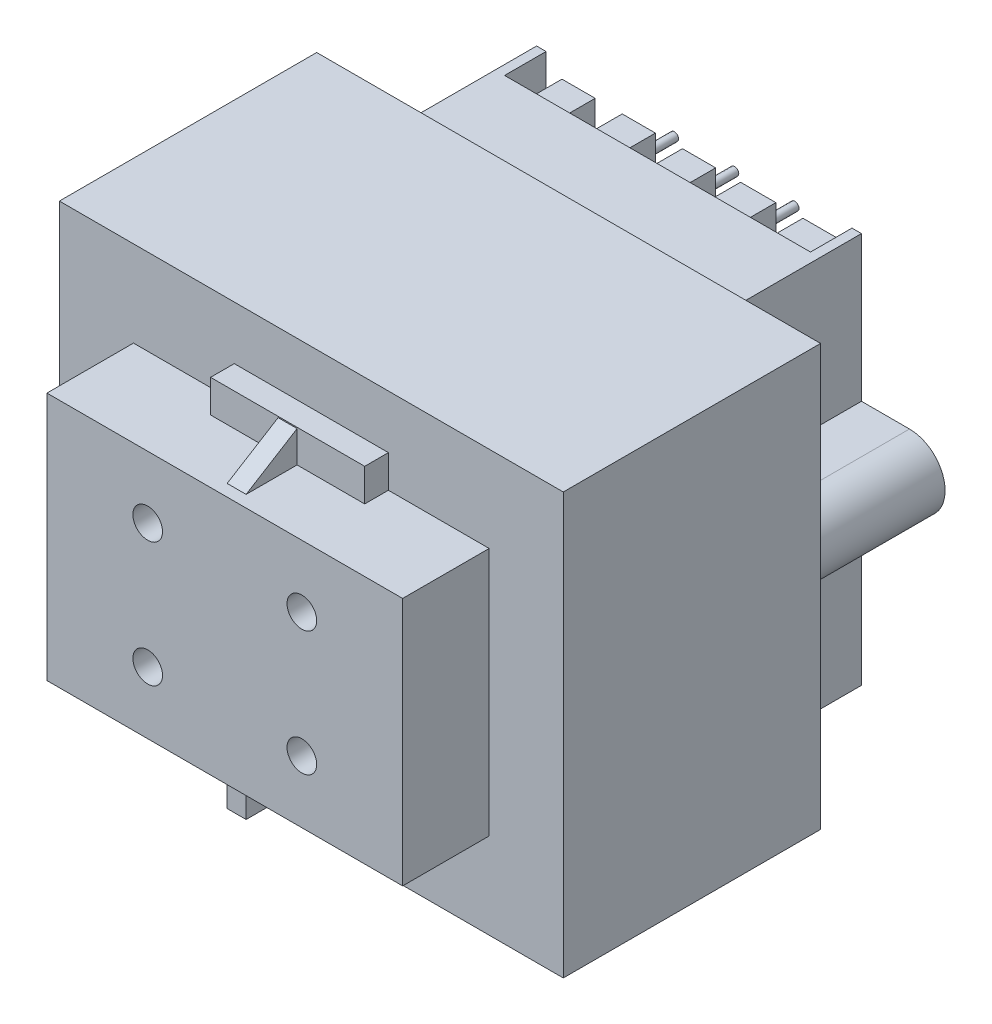
from build123d import *

# Parameters (mm, degrees)
SKETCH_1_W                 = 42.5
SKETCH_1_H                 = 35.5
EXTRUDE_1_DEPTH            = 40
SKETCH_2_W                 = 42.5
SKETCH_2_H                 = 35.5
SKETCH_2_W_2               = 30
SKETCH_2_H_2               = 21
CUT_EXTRUDE_1_DEPTH        = 7.3
SKETCH_3_W                 = 13
SKETCH_3_H                 = 26.5
EXTRUDE_2_DEPTH            = 2
EXTRUDE_3_DEPTH            = 0.8
EXTRUDE_3_DEPTH_BACK       = 0.8
SKETCH_4_W                 = 4.3
SKETCH_4_H                 = 2.75
SKETCH_5_R                 = 1.25
CUT_EXTRUDE_2_DEPTH        = 2
SKETCH_6_W                 = 42.5
SKETCH_6_H                 = 35.5
CUT_EXTRUDE_3_DEPTH        = 11
SKETCH_7_W                 = 2.5
SKETCH_7_H                 = 2.5
CUT_EXTRUDE_4_DEPTH        = 8
SKETCH_8_W                 = 25.8
SKETCH_8_H                 = 4.25
SKETCH_8_H_2               = 6.75
CUT_EXTRUDE_5_DEPTH        = 11
CUT_EXTRUDE_6_DEPTH        = 3.5
SKETCH_10_W                = 2.1
SKETCH_10_H                = 4.65
SKETCH_10_W_2              = 2.28
SKETCH_10_W_3              = 0.939967479
CUT_EXTRUDE_7_DEPTH        = 3.5
SKETCH_11_R                = 0.35
EXTRUDE_4_DEPTH            = 3
PATTERN_LINEAR_1_COUNT     = 3
PATTERN_LINEAR_1_PITCH     = 5.08
PATTERN_LINEAR_1_COL_COUNT = 3
PATTERN_LINEAR_1_COL_PITCH = 5.08
CUT_EXTRUDE_START          = -3
SKETCH_12_R                = 0.35
CUT_EXTRUDE_8_DEPTH        = 3


with BuildPart() as part:
    # Эскиз1 → Вытянуть1 (new body)
    with BuildSketch(Plane.XY):
        Rectangle(SKETCH_1_W, SKETCH_1_H)
    extrude(amount=EXTRUDE_1_DEPTH)

    # Эскиз2 → Вырез-Вытянуть1 (cut)
    with BuildSketch(Plane.XY.offset(40)):
        Rectangle(SKETCH_2_W, SKETCH_2_H)
        Rectangle(SKETCH_2_W_2, SKETCH_2_H_2, mode=Mode.SUBTRACT)
    extrude(amount=-CUT_EXTRUDE_1_DEPTH, mode=Mode.SUBTRACT)

    # Эскиз3 → Вытянуть2 (add)
    with BuildSketch(Plane.XY.offset(32.7)):
        Rectangle(SKETCH_3_W, SKETCH_3_H)
    extrude(amount=EXTRUDE_2_DEPTH)

    # Эскиз4 → Вытянуть3 (add, two sides: drawn at the far end of the back side and taken through both)
    with BuildSketch(Plane(origin=(0, 0, 0), x_dir=(0, 0, -1), z_dir=(1, 0, 0)).offset(-EXTRUDE_3_DEPTH_BACK)):
        Polygon((-34.7, 10.5), (-39, 10.5), (-34.7, 13.153893026), align=None)
        with Locations((-36.85, -11.875)):
            Rectangle(SKETCH_4_W, SKETCH_4_H)
    extrude(amount=EXTRUDE_3_DEPTH + EXTRUDE_3_DEPTH_BACK)

    # Эскиз5 → Вырез-Вытянуть2 (cut)
    with BuildSketch(Plane.XY.offset(40)):
        with Locations((-6.5, 5.25)):
            Circle(SKETCH_5_R)
        with Locations((6.5, 5.25)):
            Circle(SKETCH_5_R)
        with Locations((6.5, -5.25)):
            Circle(SKETCH_5_R)
        with Locations((-6.5, -5.25)):
            Circle(SKETCH_5_R)
    extrude(amount=-CUT_EXTRUDE_2_DEPTH, mode=Mode.SUBTRACT)

    # Эскиз6 → Вырез-Вытянуть3 (cut)
    with BuildSketch(Plane(origin=(0, 0, 0), x_dir=(-1, 0, 0), z_dir=(0, 0, -1))):
        Rectangle(SKETCH_6_W, SKETCH_6_H)
        with BuildLine():
            Line((-17.75, 4.25), (-13.7, 4.25))
            Line((-13.7, 4.25), (-13.7, 16.5))
            Line((-13.7, 16.5), (13.7, 16.5))
            Line((13.7, 16.5), (13.7, 4.25))
            Line((13.7, 4.25), (17.75, 4.25))
            ThreePointArc((17.75, 4.25), (20.75, 1.25), (17.75, -1.75))
            Line((17.75, -1.75), (13.7, -1.75))
            Line((13.7, -1.75), (13.7, -16.5))
            Line((13.7, -16.5), (-13.7, -16.5))
            Line((-13.7, -16.5), (-13.7, -1.75))
            Line((-13.7, -1.75), (-17.75, -1.75))
            ThreePointArc((-17.75, -1.75), (-20.75, 1.25), (-17.75, 4.25))
        make_face(mode=Mode.SUBTRACT)
    extrude(amount=-CUT_EXTRUDE_3_DEPTH, mode=Mode.SUBTRACT)

    # Эскиз7 → Вырез-Вытянуть4 (cut)
    with BuildSketch(Plane(origin=(0, 0, 0), x_dir=(-1, 0, 0), z_dir=(0, 0, -1))):
        with Locations((17.25, 1.25)):
            Rectangle(SKETCH_7_W, SKETCH_7_H)
        with Locations((-17.25, 1.25)):
            Rectangle(SKETCH_7_W, SKETCH_7_H)
    extrude(amount=-CUT_EXTRUDE_4_DEPTH, mode=Mode.SUBTRACT)

    # Эскиз8 → Вырез-Вытянуть5 (cut)
    with BuildSketch(Plane(origin=(0, 0, 0), x_dir=(-1, 0, 0), z_dir=(0, 0, -1))):
        with Locations((0, 8.375)):
            Rectangle(SKETCH_8_W, SKETCH_8_H)
        with Locations((0, -7.125)):
            Rectangle(SKETCH_8_W, SKETCH_8_H_2)
    extrude(amount=-CUT_EXTRUDE_5_DEPTH, mode=Mode.SUBTRACT)

    # Эскиз9 → Вырез-Вытянуть6 (cut)
    with BuildSketch(Plane(origin=(0, 0, 0), x_dir=(-1, 0, 0), z_dir=(0, 0, -1))):
        Polygon((12.9, 16.5), (-12.9, 16.5), (-12.9, 10.5), (-12.1, 10.5), (-12.1, 15.15), (12.1, 15.15), (12.1, 10.5), (12.9, 10.5), align=None)
        Polygon((12.9, -10.5), (12.9, -16.5), (-12.9, -16.5), (-12.9, -10.5), (-12.1, -10.5), (-12.1, -15.15), (12.1, -15.15), (12.1, -10.5), align=None)
    extrude(amount=-CUT_EXTRUDE_6_DEPTH, mode=Mode.SUBTRACT)

    # Эскиз10 → Вырез-Вытянуть7 (cut)
    with BuildSketch(Plane(origin=(0, 0, 0), x_dir=(-1, 0, 0), z_dir=(0, 0, -1))):
        with Locations((-2.45, 12.825)):
            Rectangle(SKETCH_10_W, SKETCH_10_H)
        with Locations((2.54, 12.825)):
            Rectangle(SKETCH_10_W_2, SKETCH_10_H)
        with Locations((7.62, 12.825)):
            Rectangle(SKETCH_10_W_2, SKETCH_10_H)
        with Locations((12.02998374, 12.825)):
            Rectangle(SKETCH_10_W_3, SKETCH_10_H)
        with Locations((-12.02998374, 12.825)):
            Rectangle(SKETCH_10_W_3, SKETCH_10_H)
        with Locations((-7.62, 12.825)):
            Rectangle(SKETCH_10_W_2, SKETCH_10_H)
        with Locations((-7.62, -12.825)):
            Rectangle(SKETCH_10_W_2, SKETCH_10_H)
        with Locations((-12.02998374, -12.825)):
            Rectangle(SKETCH_10_W_3, SKETCH_10_H)
        with Locations((12.02998374, -12.825)):
            Rectangle(SKETCH_10_W_3, SKETCH_10_H)
        with Locations((7.62, -12.825)):
            Rectangle(SKETCH_10_W_2, SKETCH_10_H)
        with Locations((2.54, -12.825)):
            Rectangle(SKETCH_10_W_2, SKETCH_10_H)
        with Locations((-2.45, -12.825)):
            Rectangle(SKETCH_10_W, SKETCH_10_H)
    extrude(amount=-CUT_EXTRUDE_7_DEPTH, mode=Mode.SUBTRACT)

    # Эскиз11 → Вытянуть4 (add)
    with BuildSketch(Plane(origin=(0, 0, 0), x_dir=(-1, 0, 0), z_dir=(0, 0, -1))):
        with Locations((0, 12.7)):
            Circle(SKETCH_11_R)
        with Locations(Location((0, -12.7, 0), (0, 0, 180))):
            Circle(SKETCH_11_R)
    extrude_4 = extrude(amount=EXTRUDE_4_DEPTH)

    # Линейный массив1: Вытянуть4 ×3
    with Locations(*[(i * PATTERN_LINEAR_1_PITCH, 0, 0) for i in range(1, PATTERN_LINEAR_1_COUNT)]):
        add(extrude_4)

    # Линейный массив1 col: Вытянуть4 ×3
    with Locations(*[(-i * PATTERN_LINEAR_1_COL_PITCH, 0, 0) for i in range(1, PATTERN_LINEAR_1_COL_COUNT)]):
        add(extrude_4)

    # Эскиз12 → Вырез-Вытянуть8 (cut)
    with BuildSketch(Plane(origin=(0, 0, -3), x_dir=(-1, 0, 0), z_dir=(0, 0, -1)).offset(CUT_EXTRUDE_START)):
        with Locations((10.16, 12.7)):
            Circle(SKETCH_12_R)
        with Locations((10.16, -12.7)):
            Circle(SKETCH_12_R)
        with Locations((0, -12.7)):
            Circle(SKETCH_12_R)
        with Locations((-5.08, -12.7)):
            Circle(SKETCH_12_R)
    extrude(amount=CUT_EXTRUDE_8_DEPTH, mode=Mode.SUBTRACT)


solid = part.part
